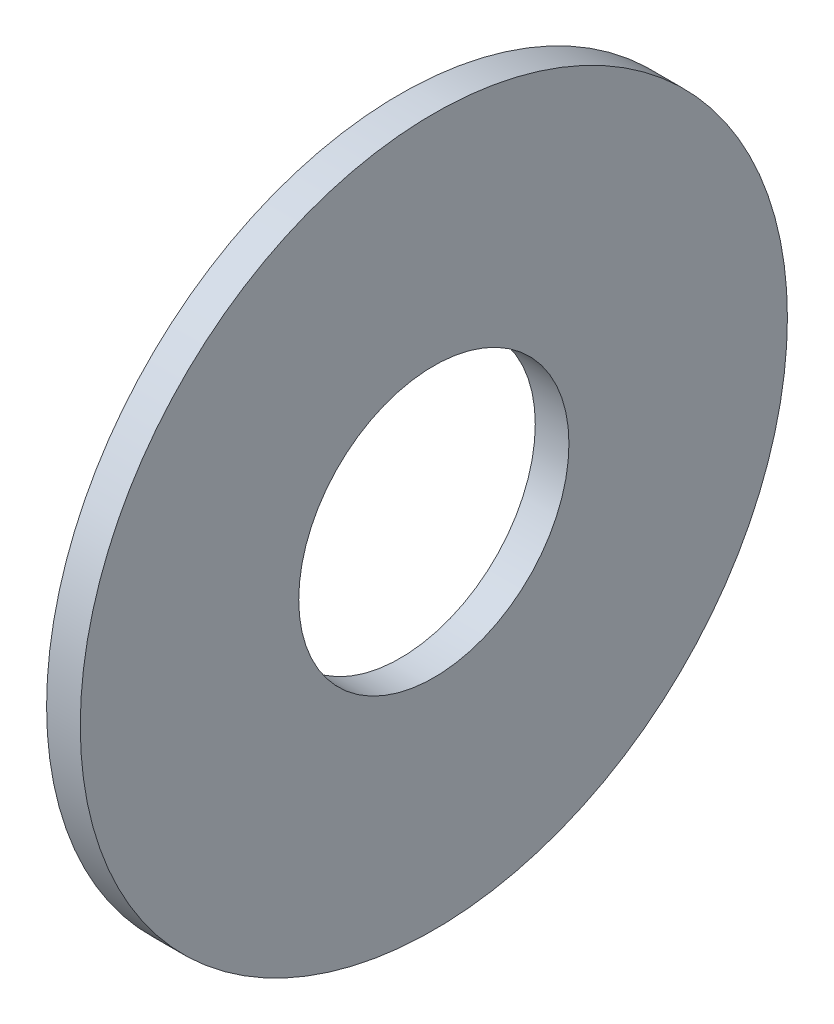
from build123d import *

# Parameters (mm, degrees)
BOSS_EXTRUDE1_DEPTH      = 0.5
BOSS_EXTRUDE1_DEPTH_BACK = 0.5
SKETCH3_R                = 10.5
SKETCH3_R_2              = 4.0125


with BuildPart() as part:
    # Sketch3 → Boss-Extrude1 (new, two sides: drawn at the far end of the back side and taken through both)
    with BuildSketch(Plane(origin=(0, 0, 0), x_dir=(0, 0, -1), z_dir=(1, 0, 0)).offset(-BOSS_EXTRUDE1_DEPTH_BACK)):
        Circle(SKETCH3_R)
        Circle(SKETCH3_R_2, mode=Mode.SUBTRACT)
    extrude(amount=BOSS_EXTRUDE1_DEPTH + BOSS_EXTRUDE1_DEPTH_BACK)


solid = part.part
